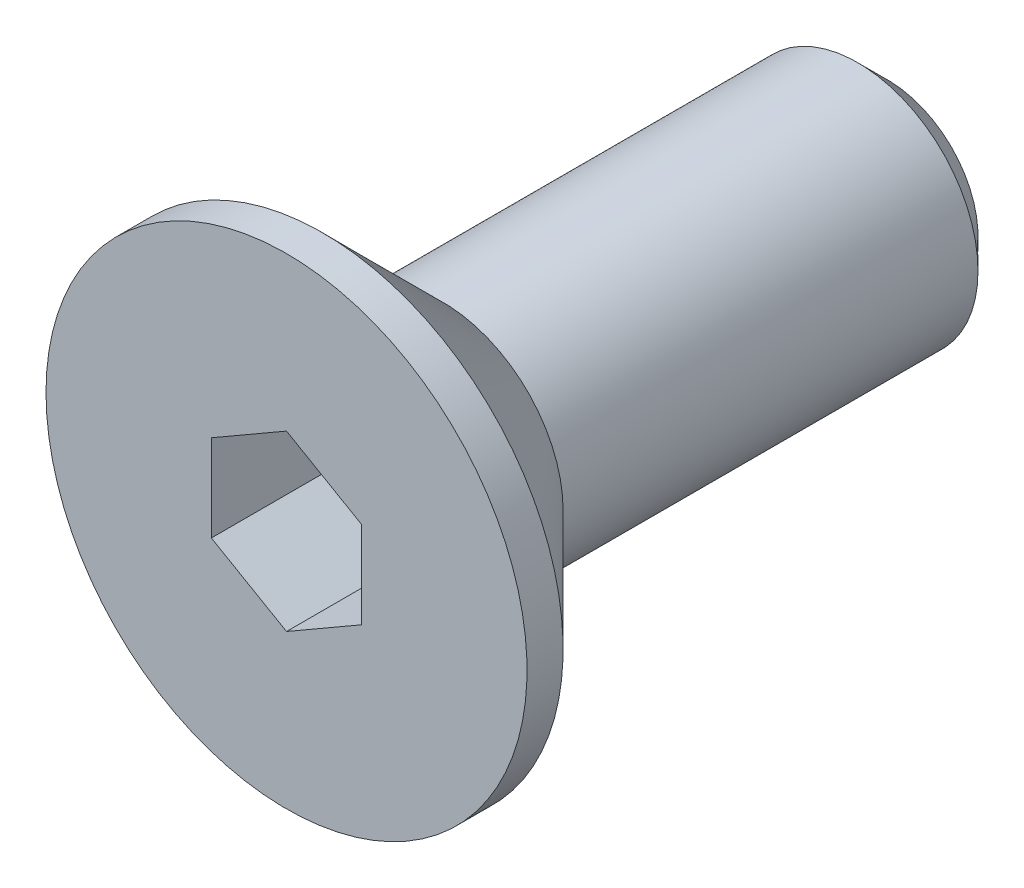
from build123d import *

# Parameters (mm, degrees)
CHAMFER_1_SIZE      = 0.5
CUT_EXTRUDE_1_DEPTH = 2.5


with BuildPart() as part:
    # 草图1 → 旋转1 (revolve)
    with BuildSketch(Plane(origin=(0, 0, 0), x_dir=(0, 0, -1), z_dir=(1, 0, 0)), mode=Mode.PRIVATE) as revolve_1_sk:
        Polygon((-5, 0), (-5, 4), (-4.4, 4), (-2.4, 2), (5, 2), (5, 0), align=None)
    revolve(revolve_1_sk.sketch.rotate(Axis((0, 0, -5), (0, 0, 1)), 90), axis=Axis((0, 0, -5), (0, 0, 1)))

    # 倒角1
    chamfer_1_edges = [part.edges().sort_by_distance(p)[0] for p in [
        (2, 0, -5),
    ]]
    chamfer(chamfer_1_edges, length=CHAMFER_1_SIZE)

    # 草图2 → 切除-拉伸1 (cut)
    with BuildSketch(Plane.XY.offset(5)):
        Polygon((0, 1.443375673), (-1.25, 0.721687836), (-1.25, -0.721687836), (0, -1.443375673), (1.25, -0.721687836), (1.25, 0.721687836), align=None)
    extrude(amount=-CUT_EXTRUDE_1_DEPTH, mode=Mode.SUBTRACT)


solid = part.part
